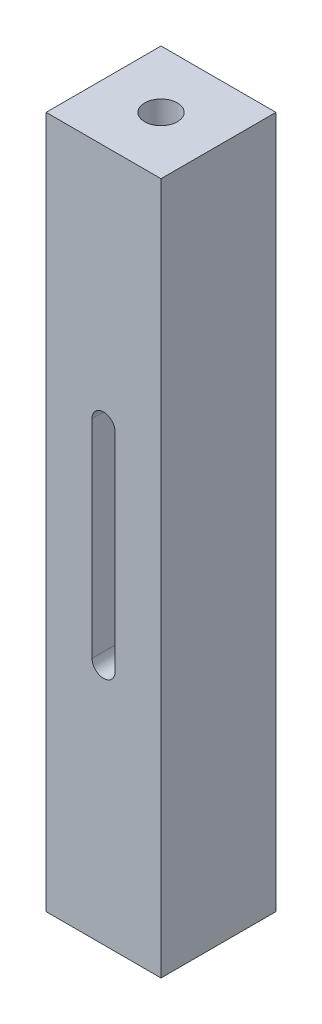
from build123d import *

# Parameters (mm, degrees)
SKETCH2_W               = 24.9
SKETCH2_H               = 24.9
SKETCH2_R               = 3.55
BOSS_EXTRUDE1_DEPTH     = 150
CUT_EXTRUDE1_REACH      = 156.078
CUT_EXTRUDE1_END_RADIUS = 3.55


with BuildPart() as part:
    # Sketch2 → Boss-Extrude1 (new body)
    with BuildSketch(Plane(origin=(0, 0, 0), x_dir=(1, 0, 0), z_dir=(0, 1, 0))):
        with Locations((-12.45, 12.45)):
            Rectangle(SKETCH2_W, SKETCH2_H)
        with Locations(Location((-12.45, 12.45, 0), (0, 0, 270))):
            Circle(SKETCH2_R, mode=Mode.SUBTRACT)
    extrude(amount=BOSS_EXTRUDE1_DEPTH)

    # Cut-Extrude1: up to this cylinder (the profile starts outside it)
    cut_extrude1_end = Plane(origin=(-12.45, 75, -12.45), z_dir=(0, -1, 0)) * Cylinder(CUT_EXTRUDE1_END_RADIUS, 320.256, mode=Mode.PRIVATE)
    # Sketch3 → Cut-Extrude1 (cut, up to the surface)
    with BuildSketch(Plane.XY, mode=Mode.PRIVATE) as cut_extrude1_sk1:
        with BuildLine():
            Line((-14.95, 97.5), (-14.95, 52.5))
            ThreePointArc((-14.95, 52.5), (-12.45, 50), (-9.95, 52.5))
            Line((-9.95, 52.5), (-9.95, 97.5))
            ThreePointArc((-9.95, 97.5), (-12.45, 100), (-14.95, 97.5))
        make_face()
    cut_extrude1_tool1 = extrude(cut_extrude1_sk1.sketch, amount=-CUT_EXTRUDE1_REACH, mode=Mode.PRIVATE) - cut_extrude1_end
    add(cut_extrude1_tool1.solids().sort_by_distance((-12.45, 75, 0))[0], mode=Mode.SUBTRACT)


solid = part.part
